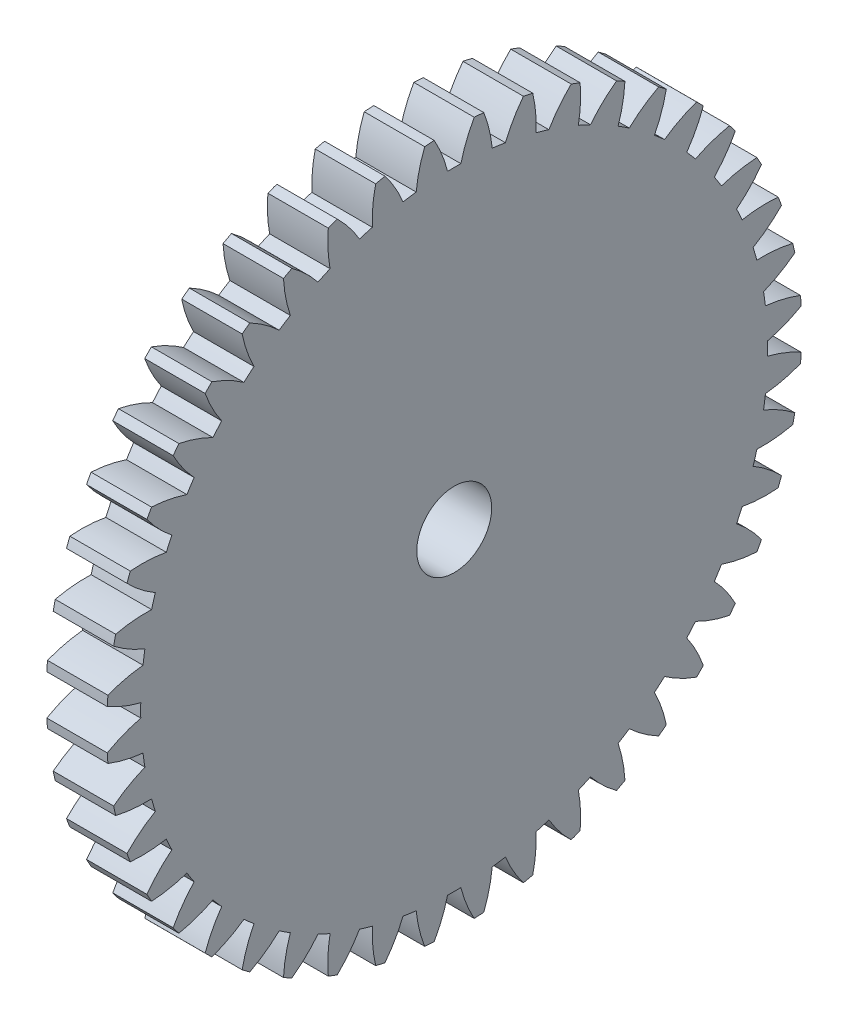
from build123d import *

# Parameters (mm, degrees)
SKETCH1_R               = 0.396875
BOSS_EXTRUDE1_DEPTH     = 6.35
CUT_EXTRUDE1_DEPTH      = 67.851514831
CUT_EXTRUDE1_DEPTH_BACK = 67.851514831
SKETCH2_R               = 3.937


with BuildPart() as part:
    # Sketch1 → Boss-Extrude1 (new body)
    with BuildSketch(Plane(origin=(3.175, 0, 0), x_dir=(0, 0, -1), z_dir=(1, 0, 0))):
        with BuildLine():
            ThreePointArc((-52.308733695, 6.793677518), (-50.596662873, 5.971226891), (-48.788853834, 5.388613802))
            ThreePointArc((-48.788853834, 5.388613802), (-48.796276004, 4.689394321), (-48.788853834, 3.990174841))
            ThreePointArc((-48.788853834, 3.990174841), (-50.596662873, 3.407561751), (-52.308733695, 2.585111124))
            ThreePointArc((-52.308733695, 2.585111124), (-52.276391338, 2.084622395), (-52.237177524, 1.584625121))
            ThreePointArc((-52.237177524, 1.584625121), (-50.425486186, 1.014198938), (-48.553163549, 0.694794061))
            ThreePointArc((-48.553163549, 0.694794061), (-48.461000864, 0.001635342), (-48.354144934, -0.689410808))
            ThreePointArc((-48.354144934, -0.689410808), (-50.060638596, -1.523371787), (-51.638236078, -2.581104135))
            ThreePointArc((-51.638236078, -2.581104135), (-51.534995947, -3.071895814), (-51.425024242, -3.561223128))
            ThreePointArc((-51.425024242, -3.561223128), (-49.5505932, -3.868012636), (-47.651872054, -3.917707138))
            ThreePointArc((-47.651872054, -3.917707138), (-47.462000682, -4.590694384), (-47.25788627, -5.259499495))
            ThreePointArc((-47.25788627, -5.259499495), (-48.828325265, -6.327831324), (-50.239334071, -7.599313012))
            ThreePointArc((-50.239334071, -7.599313012), (-50.067297838, -8.070416536), (-49.888806948, -8.539112599))
            ThreePointArc((-49.888806948, -8.539112599), (-47.989794212, -8.576020081), (-46.103327044, -8.354992572))
            ThreePointArc((-46.103327044, -8.354992572), (-45.819612218, -8.994108264), (-45.522394505, -9.627057395))
            ThreePointArc((-45.522394505, -9.627057395), (-46.924809225, -10.908011917), (-48.140505285, -12.367359245))
            ThreePointArc((-48.140505285, -12.367359245), (-47.90317511, -12.809184306), (-47.659798596, -13.247707816))
            ThreePointArc((-47.659798596, -13.247707816), (-45.774862589, -13.013981943), (-43.939052432, -12.526731906))
            ThreePointArc((-43.939052432, -12.526731906), (-43.567269767, -13.118965492), (-43.182999248, -13.703173623))
            ThreePointArc((-43.182999248, -13.703173623), (-44.388840572, -15.170674299), (-45.38447582, -16.788179163))
            ThreePointArc((-45.38447582, -16.788179163), (-45.086683063, -17.191731477), (-44.783375368, -17.591155361))
            ThreePointArc((-44.783375368, -17.591155361), (-42.950887952, -17.091554117), (-41.203106605, -16.348000557))
            ThreePointArc((-41.203106605, -16.348000557), (-40.750824524, -16.88129587), (-40.28732384, -17.404870207))
            ThreePointArc((-40.28732384, -17.404870207), (-41.272044317, -19.029042955), (-42.027350491, -20.771777622))
            ThreePointArc((-42.027350491, -20.771777622), (-41.675157352, -21.128842027), (-41.318092947, -21.481035166))
            ThreePointArc((-41.318092947, -21.481035166), (-39.57535828, -20.725728992), (-37.951185532, -19.741008516))
            ThreePointArc((-37.951185532, -19.741008516), (-37.427611195, -20.2045092), (-36.894315882, -20.65679128))
            ThreePointArc((-36.894315882, -20.65679128), (-37.637869442, -22.404572627), (-38.137470686, -24.237060043))
            ThreePointArc((-38.137470686, -24.237060043), (-37.738046802, -24.540367738), (-37.334494488, -24.838160496))
            ThreePointArc((-37.334494488, -24.838160496), (-35.716989624, -23.842525248), (-34.249488948, -22.636683924))
            ThreePointArc((-34.249488948, -22.636683924), (-33.665280817, -23.020954442), (-33.073047231, -23.392737107))
            ThreePointArc((-33.073047231, -23.392737107), (-33.560297268, -25.228547264), (-33.794023141, -27.113483271))
            ThreePointArc((-33.794023141, -27.113483271), (-33.355499631, -27.356859785), (-32.91367457, -27.59418996))
            ThreePointArc((-32.91367457, -27.59418996), (-31.454327242, -26.3784939), (-30.17337272, -24.97607918))
            ThreePointArc((-30.17337272, -24.97607918), (-29.540423589, -25.273296893), (-28.901307897, -25.55701172))
            ThreePointArc((-28.901307897, -25.55701172), (-29.122335406, -27.443478887), (-29.085427923, -29.342491623))
            ThreePointArc((-29.085427923, -29.342491623), (-28.616731861, -29.520982513), (-28.145628337, -29.693018746))
            ThreePointArc((-28.145628337, -29.693018746), (-26.874146649, -28.28200994), (-25.80581482, -26.711570945))
            ThreePointArc((-25.80581482, -26.711570945), (-25.137009708, -26.915685357), (-24.464022463, -27.105556729))
            ThreePointArc((-24.464022463, -27.105556729), (-24.41432796, -29.004277875), (-24.107538453, -30.878708917))
            ThreePointArc((-24.107538453, -30.878708917), (-23.618211138, -30.988680623), (-23.12741946, -31.091920753))
            ThreePointArc((-23.12741946, -31.091920753), (-22.069687112, -29.514323272), (-21.235726133, -27.807829609))
            ThreePointArc((-21.235726133, -27.807829609), (-20.544679983, -27.91468554), (-19.851521264, -28.006848224))
            ThreePointArc((-19.851521264, -28.006848224), (-19.532116387, -29.879170861), (-18.961690203, -31.690862199))
            ThreePointArc((-18.961690203, -31.690862199), (-18.46169293, -31.730076014), (-17.961204201, -31.76241837))
            ThreePointArc((-17.961204201, -31.76241837), (-17.138753573, -30.050347548), (-16.556140484, -28.242538509))
            ThreePointArc((-16.556140484, -28.242538509), (-15.856921004, -28.249960679), (-15.157701523, -28.242538509))
            ThreePointArc((-15.157701523, -28.242538509), (-14.575088434, -30.050347548), (-13.752637807, -31.76241837))
            ThreePointArc((-13.752637807, -31.76241837), (-13.252149077, -31.730076014), (-12.752151804, -31.690862199))
            ThreePointArc((-12.752151804, -31.690862199), (-12.18172562, -29.879170861), (-11.862320743, -28.006848224))
            ThreePointArc((-11.862320743, -28.006848224), (-11.169162024, -27.91468554), (-10.478115874, -27.807829609))
            ThreePointArc((-10.478115874, -27.807829609), (-9.644154895, -29.514323272), (-8.586422548, -31.091920753))
            ThreePointArc((-8.586422548, -31.091920753), (-8.095630869, -30.988680623), (-7.606303555, -30.878708917))
            ThreePointArc((-7.606303555, -30.878708917), (-7.299514047, -29.004277875), (-7.249819544, -27.105556729))
            ThreePointArc((-7.249819544, -27.105556729), (-6.576832299, -26.915685357), (-5.908027187, -26.711570945))
            ThreePointArc((-5.908027187, -26.711570945), (-4.839695359, -28.28200994), (-3.568213671, -29.693018746))
            ThreePointArc((-3.568213671, -29.693018746), (-3.097110146, -29.520982513), (-2.628414084, -29.342491623))
            ThreePointArc((-2.628414084, -29.342491623), (-2.591506602, -27.443478887), (-2.81253411, -25.55701172))
            ThreePointArc((-2.81253411, -25.55701172), (-2.173418418, -25.273296893), (-1.540469287, -24.97607918))
            ThreePointArc((-1.540469287, -24.97607918), (-0.259514765, -26.3784939), (1.199832563, -27.59418996))
            ThreePointArc((1.199832563, -27.59418996), (1.641657624, -27.356859785), (2.080181134, -27.113483271))
            ThreePointArc((2.080181134, -27.113483271), (1.846455261, -25.228547264), (1.359205224, -23.392737107))
            ThreePointArc((1.359205224, -23.392737107), (1.95143881, -23.020954442), (2.53564694, -22.636683924))
            ThreePointArc((2.53564694, -22.636683924), (4.003147617, -23.842525248), (5.620652481, -24.838160496))
            ThreePointArc((5.620652481, -24.838160496), (6.024204795, -24.540367738), (6.423628679, -24.237060043))
            ThreePointArc((6.423628679, -24.237060043), (5.924027435, -22.404572627), (5.180473875, -20.65679128))
            ThreePointArc((5.180473875, -20.65679128), (5.713769187, -20.2045092), (6.237343525, -19.741008516))
            ThreePointArc((6.237343525, -19.741008516), (7.861516273, -20.725728992), (9.604250939, -21.481035166))
            ThreePointArc((9.604250939, -21.481035166), (9.961315344, -21.128842027), (10.313508483, -20.771777622))
            ThreePointArc((10.313508483, -20.771777622), (9.55820231, -19.029042955), (8.573481833, -17.404870207))
            ThreePointArc((8.573481833, -17.404870207), (9.036982517, -16.88129587), (9.489264598, -16.348000557))
            ThreePointArc((9.489264598, -16.348000557), (11.237045945, -17.091554117), (13.069533361, -17.591155361))
            ThreePointArc((13.069533361, -17.591155361), (13.372841056, -17.191731477), (13.670633813, -16.788179163))
            ThreePointArc((13.670633813, -16.788179163), (12.674998565, -15.170674299), (11.469157241, -13.703173623))
            ThreePointArc((11.469157241, -13.703173623), (11.853427759, -13.118965492), (12.225210424, -12.526731906))
            ThreePointArc((12.225210424, -12.526731906), (14.061020582, -13.013981943), (15.945956589, -13.247707816))
            ThreePointArc((15.945956589, -13.247707816), (16.189333103, -12.809184306), (16.426663277, -12.367359245))
            ThreePointArc((16.426663277, -12.367359245), (15.210967217, -10.908011917), (13.808552498, -9.627057395))
            ThreePointArc((13.808552498, -9.627057395), (14.105770211, -8.994108264), (14.389485037, -8.354992572))
            ThreePointArc((14.389485037, -8.354992572), (16.275952205, -8.576020081), (18.174964941, -8.539112599))
            ThreePointArc((18.174964941, -8.539112599), (18.35345583, -8.070416536), (18.525492064, -7.599313012))
            ThreePointArc((18.525492064, -7.599313012), (17.114483258, -6.327831324), (15.544044262, -5.259499495))
            ThreePointArc((15.544044262, -5.259499495), (15.748158674, -4.590694384), (15.938030047, -3.917707138))
            ThreePointArc((15.938030047, -3.917707138), (17.836751192, -3.868012636), (19.711182235, -3.561223128))
            ThreePointArc((19.711182235, -3.561223128), (19.82115394, -3.071895814), (19.924394071, -2.581104135))
            ThreePointArc((19.924394071, -2.581104135), (18.346796589, -1.523371787), (16.640302927, -0.689410808))
            ThreePointArc((16.640302927, -0.689410808), (16.747158857, 0.001635342), (16.839321542, 0.694794061))
            ThreePointArc((16.839321542, 0.694794061), (18.711644179, 1.014198938), (20.523335516, 1.584625121))
            ThreePointArc((20.523335516, 1.584625121), (20.562549331, 2.084622395), (20.594891688, 2.585111124))
            ThreePointArc((20.594891688, 2.585111124), (18.882820866, 3.407561751), (17.075011827, 3.990174841))
            ThreePointArc((17.075011827, 3.990174841), (17.082433996, 4.689394321), (17.075011827, 5.388613802))
            ThreePointArc((17.075011827, 5.388613802), (18.882820866, 5.971226891), (20.594891688, 6.793677518))
            ThreePointArc((20.594891688, 6.793677518), (20.562549331, 7.294166248), (20.523335516, 7.794163521))
            ThreePointArc((20.523335516, 7.794163521), (18.711644179, 8.364589704), (16.839321542, 8.683994581))
            ThreePointArc((16.839321542, 8.683994581), (16.747158857, 9.377153301), (16.640302927, 10.06819945))
            ThreePointArc((16.640302927, 10.06819945), (18.346796589, 10.90216043), (19.924394071, 11.959892777))
            ThreePointArc((19.924394071, 11.959892777), (19.82115394, 12.450684456), (19.711182235, 12.94001177))
            ThreePointArc((19.711182235, 12.94001177), (17.836751192, 13.246801278), (15.938030047, 13.296495781))
            ThreePointArc((15.938030047, 13.296495781), (15.748158674, 13.969483026), (15.544044262, 14.638288138))
            ThreePointArc((15.544044262, 14.638288138), (17.114483258, 15.706619966), (18.525492064, 16.978101654))
            ThreePointArc((18.525492064, 16.978101654), (18.35345583, 17.449205179), (18.174964941, 17.917901241))
            ThreePointArc((18.174964941, 17.917901241), (16.275952205, 17.954808723), (14.389485037, 17.733781215))
            ThreePointArc((14.389485037, 17.733781215), (14.105770211, 18.372896907), (13.808552498, 19.005846037))
            ThreePointArc((13.808552498, 19.005846037), (15.210967217, 20.28680056), (16.426663277, 21.746147888))
            ThreePointArc((16.426663277, 21.746147888), (16.189333103, 22.187972949), (15.945956589, 22.626496459))
            ThreePointArc((15.945956589, 22.626496459), (14.061020582, 22.392770586), (12.225210424, 21.905520549))
            ThreePointArc((12.225210424, 21.905520549), (11.853427759, 22.497754135), (11.469157241, 23.081962265))
            ThreePointArc((11.469157241, 23.081962265), (12.674998565, 24.549462941), (13.670633813, 26.166967806))
            ThreePointArc((13.670633813, 26.166967806), (13.372841056, 26.57052012), (13.069533361, 26.969944003))
            ThreePointArc((13.069533361, 26.969944003), (11.237045945, 26.47034276), (9.489264598, 25.7267892))
            ThreePointArc((9.489264598, 25.7267892), (9.036982517, 26.260084512), (8.573481833, 26.783658849))
            ThreePointArc((8.573481833, 26.783658849), (9.55820231, 28.407831598), (10.313508483, 30.150566264))
            ThreePointArc((10.313508483, 30.150566264), (9.961315344, 30.507630669), (9.604250939, 30.859823808))
            ThreePointArc((9.604250939, 30.859823808), (7.861516273, 30.104517635), (6.237343525, 29.119797158))
            ThreePointArc((6.237343525, 29.119797158), (5.713769187, 29.583297842), (5.180473875, 30.035579923))
            ThreePointArc((5.180473875, 30.035579923), (5.924027435, 31.78336127), (6.423628679, 33.615848686))
            ThreePointArc((6.423628679, 33.615848686), (6.024204795, 33.91915638), (5.620652481, 34.216949138))
            ThreePointArc((5.620652481, 34.216949138), (4.003147617, 33.22131389), (2.53564694, 32.015472566))
            ThreePointArc((2.53564694, 32.015472566), (1.95143881, 32.399743084), (1.359205224, 32.771525749))
            ThreePointArc((1.359205224, 32.771525749), (1.846455261, 34.607335907), (2.080181134, 36.492271914))
            ThreePointArc((2.080181134, 36.492271914), (1.641657624, 36.735648428), (1.199832563, 36.972978602))
            ThreePointArc((1.199832563, 36.972978602), (-0.259514765, 35.757282542), (-1.540469287, 34.354867823))
            ThreePointArc((-1.540469287, 34.354867823), (-2.173418418, 34.652085536), (-2.81253411, 34.935800362))
            ThreePointArc((-2.81253411, 34.935800362), (-2.591506602, 36.82226753), (-2.628414084, 38.721280265))
            ThreePointArc((-2.628414084, 38.721280265), (-3.097110146, 38.899771155), (-3.568213671, 39.071807389))
            ThreePointArc((-3.568213671, 39.071807389), (-4.839695359, 37.660798583), (-5.908027187, 36.090359587))
            ThreePointArc((-5.908027187, 36.090359587), (-6.576832299, 36.294473999), (-7.249819544, 36.484345371))
            ThreePointArc((-7.249819544, 36.484345371), (-7.299514047, 38.383066517), (-7.606303555, 40.257497559))
            ThreePointArc((-7.606303555, 40.257497559), (-8.095630869, 40.367469265), (-8.586422548, 40.470709396))
            ThreePointArc((-8.586422548, 40.470709396), (-9.644154895, 38.893111914), (-10.478115874, 37.186618252))
            ThreePointArc((-10.478115874, 37.186618252), (-11.169162024, 37.293474182), (-11.862320743, 37.385636866))
            ThreePointArc((-11.862320743, 37.385636866), (-12.18172562, 39.257959504), (-12.752151804, 41.069650841))
            ThreePointArc((-12.752151804, 41.069650841), (-13.252149077, 41.108864656), (-13.752637807, 41.141207012))
            ThreePointArc((-13.752637807, 41.141207012), (-14.575088434, 39.42913619), (-15.157701523, 37.621327151))
            ThreePointArc((-15.157701523, 37.621327151), (-15.856921004, 37.628749321), (-16.556140484, 37.621327151))
            ThreePointArc((-16.556140484, 37.621327151), (-17.138753573, 39.42913619), (-17.961204201, 41.141207012))
            ThreePointArc((-17.961204201, 41.141207012), (-18.46169293, 41.108864656), (-18.961690203, 41.069650841))
            ThreePointArc((-18.961690203, 41.069650841), (-19.532116387, 39.257959504), (-19.851521264, 37.385636866))
            ThreePointArc((-19.851521264, 37.385636866), (-20.544679983, 37.293474182), (-21.235726133, 37.186618252))
            ThreePointArc((-21.235726133, 37.186618252), (-22.069687112, 38.893111914), (-23.12741946, 40.470709396))
            ThreePointArc((-23.12741946, 40.470709396), (-23.618211138, 40.367469265), (-24.107538453, 40.257497559))
            ThreePointArc((-24.107538453, 40.257497559), (-24.41432796, 38.383066517), (-24.464022463, 36.484345371))
            ThreePointArc((-24.464022463, 36.484345371), (-25.137009708, 36.294473999), (-25.80581482, 36.090359587))
            ThreePointArc((-25.80581482, 36.090359587), (-26.874146649, 37.660798583), (-28.145628337, 39.071807389))
            ThreePointArc((-28.145628337, 39.071807389), (-28.616731861, 38.899771155), (-29.085427923, 38.721280265))
            ThreePointArc((-29.085427923, 38.721280265), (-29.122335406, 36.82226753), (-28.901307897, 34.935800362))
            ThreePointArc((-28.901307897, 34.935800362), (-29.540423589, 34.652085536), (-30.17337272, 34.354867823))
            ThreePointArc((-30.17337272, 34.354867823), (-31.454327242, 35.757282542), (-32.91367457, 36.972978602))
            ThreePointArc((-32.91367457, 36.972978602), (-33.355499631, 36.735648428), (-33.794023141, 36.492271914))
            ThreePointArc((-33.794023141, 36.492271914), (-33.560297268, 34.607335907), (-33.073047231, 32.771525749))
            ThreePointArc((-33.073047231, 32.771525749), (-33.665280817, 32.399743084), (-34.249488948, 32.015472566))
            ThreePointArc((-34.249488948, 32.015472566), (-35.716989624, 33.22131389), (-37.334494488, 34.216949138))
            ThreePointArc((-37.334494488, 34.216949138), (-37.738046802, 33.91915638), (-38.137470686, 33.615848686))
            ThreePointArc((-38.137470686, 33.615848686), (-37.637869442, 31.78336127), (-36.894315882, 30.035579923))
            ThreePointArc((-36.894315882, 30.035579923), (-37.427611195, 29.583297842), (-37.951185532, 29.119797158))
            ThreePointArc((-37.951185532, 29.119797158), (-39.57535828, 30.104517635), (-41.318092947, 30.859823808))
            ThreePointArc((-41.318092947, 30.859823808), (-41.675157352, 30.507630669), (-42.027350491, 30.150566264))
            ThreePointArc((-42.027350491, 30.150566264), (-41.272044317, 28.407831598), (-40.28732384, 26.783658849))
            ThreePointArc((-40.28732384, 26.783658849), (-40.750824524, 26.260084512), (-41.203106605, 25.7267892))
            ThreePointArc((-41.203106605, 25.7267892), (-42.950887952, 26.47034276), (-44.783375368, 26.969944003))
            ThreePointArc((-44.783375368, 26.969944003), (-45.086683063, 26.57052012), (-45.38447582, 26.166967806))
            ThreePointArc((-45.38447582, 26.166967806), (-44.388840572, 24.549462941), (-43.182999248, 23.081962265))
            ThreePointArc((-43.182999248, 23.081962265), (-43.567269767, 22.497754135), (-43.939052432, 21.905520549))
            ThreePointArc((-43.939052432, 21.905520549), (-45.774862589, 22.392770586), (-47.659798596, 22.626496459))
            ThreePointArc((-47.659798596, 22.626496459), (-47.90317511, 22.187972949), (-48.140505285, 21.746147888))
            ThreePointArc((-48.140505285, 21.746147888), (-46.924809225, 20.28680056), (-45.522394505, 19.005846037))
            ThreePointArc((-45.522394505, 19.005846037), (-45.819612218, 18.372896907), (-46.103327044, 17.733781215))
            ThreePointArc((-46.103327044, 17.733781215), (-47.989794212, 17.954808723), (-49.888806948, 17.917901241))
            ThreePointArc((-49.888806948, 17.917901241), (-50.067297838, 17.449205179), (-50.239334071, 16.978101654))
            ThreePointArc((-50.239334071, 16.978101654), (-48.828325265, 15.706619966), (-47.25788627, 14.638288138))
            ThreePointArc((-47.25788627, 14.638288138), (-47.462000682, 13.969483026), (-47.651872054, 13.296495781))
            ThreePointArc((-47.651872054, 13.296495781), (-49.5505932, 13.246801278), (-51.425024242, 12.94001177))
            ThreePointArc((-51.425024242, 12.94001177), (-51.534995947, 12.450684456), (-51.638236078, 11.959892777))
            ThreePointArc((-51.638236078, 11.959892777), (-50.060638596, 10.90216043), (-48.354144934, 10.06819945))
            ThreePointArc((-48.354144934, 10.06819945), (-48.461000864, 9.377153301), (-48.553163549, 8.683994581))
            ThreePointArc((-48.553163549, 8.683994581), (-50.425486186, 8.364589704), (-52.237177524, 7.794163521))
            ThreePointArc((-52.237177524, 7.794163521), (-52.276391338, 7.294166248), (-52.308733695, 6.793677518))
        make_face()
        with Locations(Location((-15.856921004, 4.689394321, 0), (0, 0, 180))):
            Circle(SKETCH1_R, mode=Mode.SUBTRACT)
    extrude(amount=-BOSS_EXTRUDE1_DEPTH)

    # Sketch2 → Cut-Extrude1 (cut, two sides: drawn at the far end of the back side and taken through both)
    with BuildSketch(Plane(origin=(3.175, 0, 0), x_dir=(0, 0, -1), z_dir=(1, 0, 0)).offset(-CUT_EXTRUDE1_DEPTH_BACK)):
        with Locations((-15.856921004, 4.689394321)):
            Circle(SKETCH2_R)
    extrude(amount=CUT_EXTRUDE1_DEPTH + CUT_EXTRUDE1_DEPTH_BACK, mode=Mode.SUBTRACT)


solid = part.part
